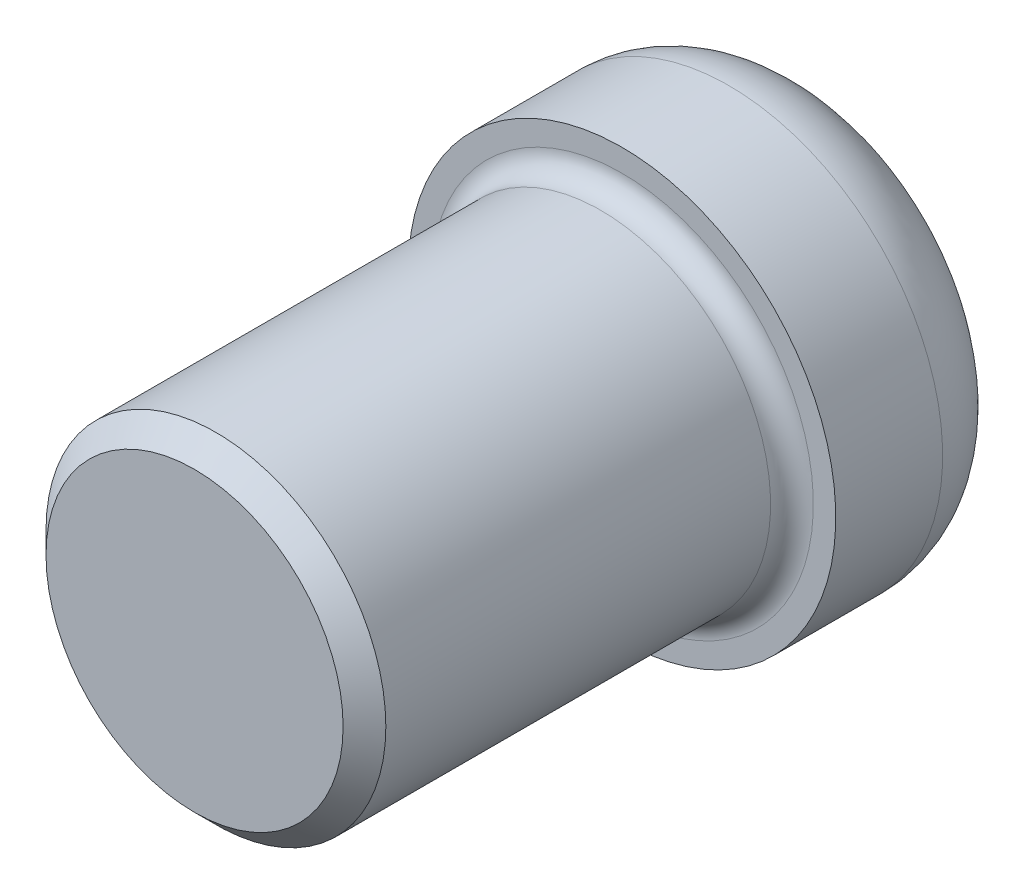
from build123d import *

# Parameters (mm, degrees)
SKETCH1_R           = 3.975
BOSS_EXTRUDE1_DEPTH = 10
SKETCH2_R           = 5
BOSS_EXTRUDE2_DEPTH = 4.5
FILLET1_R           = 2
FILLET2_R           = 0.5
CHAMFER1_SIZE       = 0.5


with BuildPart() as part:
    # Sketch1 → Boss-Extrude1 (new body)
    with BuildSketch(Plane.XY):
        Circle(SKETCH1_R)
    extrude(amount=BOSS_EXTRUDE1_DEPTH)

    # Sketch2 → Boss-Extrude2 (add)
    with BuildSketch(Plane(origin=(0, 0, 0), x_dir=(-1, 0, 0), z_dir=(0, 0, -1))):
        Circle(SKETCH2_R)
    extrude(amount=BOSS_EXTRUDE2_DEPTH)

    # Fillet1
    fillet1_edges = [part.edges().sort_by_distance(p)[0] for p in [
        (5, 0, -4.5),
    ]]
    fillet(fillet1_edges, radius=FILLET1_R)

    # Fillet2
    fillet2_edges = [part.edges().sort_by_distance(p)[0] for p in [
        (-3.975, 0, 0),
    ]]
    fillet(fillet2_edges, radius=FILLET2_R)

    # Chamfer1
    chamfer1_edges = [part.edges().sort_by_distance(p)[0] for p in [
        (-3.975, 0, 10),
    ]]
    chamfer(chamfer1_edges, length=CHAMFER1_SIZE)


solid = part.part
